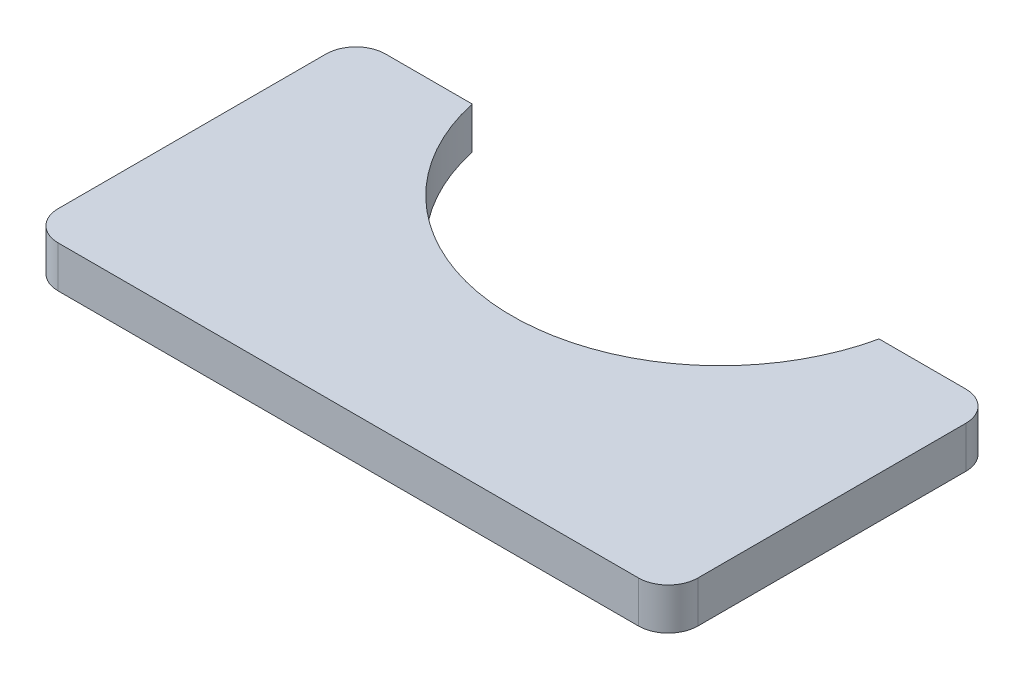
from build123d import *

# Parameters (mm, degrees)
SKETCH1_W           = 43
SKETCH1_H           = 22
BOSS_EXTRUDE1_DEPTH = 2.8
SKETCH2_R           = 14
CUT_EXTRUDE1_DEPTH  = 25.312342544
FILLET1_R           = 2


with BuildPart() as part:
    # Sketch1 → Boss-Extrude1 (new body)
    with BuildSketch(Plane(origin=(0, 0, 0), x_dir=(1, 0, 0), z_dir=(0, 1, 0))):
        Rectangle(SKETCH1_W, SKETCH1_H)
    extrude(amount=BOSS_EXTRUDE1_DEPTH)

    # Sketch2 → Cut-Extrude1 (cut, through all)
    with BuildSketch(Plane(origin=(0, 2.8, 0), x_dir=(1, 0, 0), z_dir=(0, 1, 0))):
        with Locations((0, 14)):
            Circle(SKETCH2_R)
    extrude(amount=-CUT_EXTRUDE1_DEPTH, mode=Mode.SUBTRACT)

    # Fillet1
    fillet1_edges = [part.edges().sort_by_distance(p)[0] for p in [
        (21.5, 1.4, 11),
        (-21.5, 1.4, 11),
        (-21.5, 1.4, -11),
        (21.5, 1.4, -11),
    ]]
    fillet(fillet1_edges, radius=FILLET1_R)


solid = part.part
